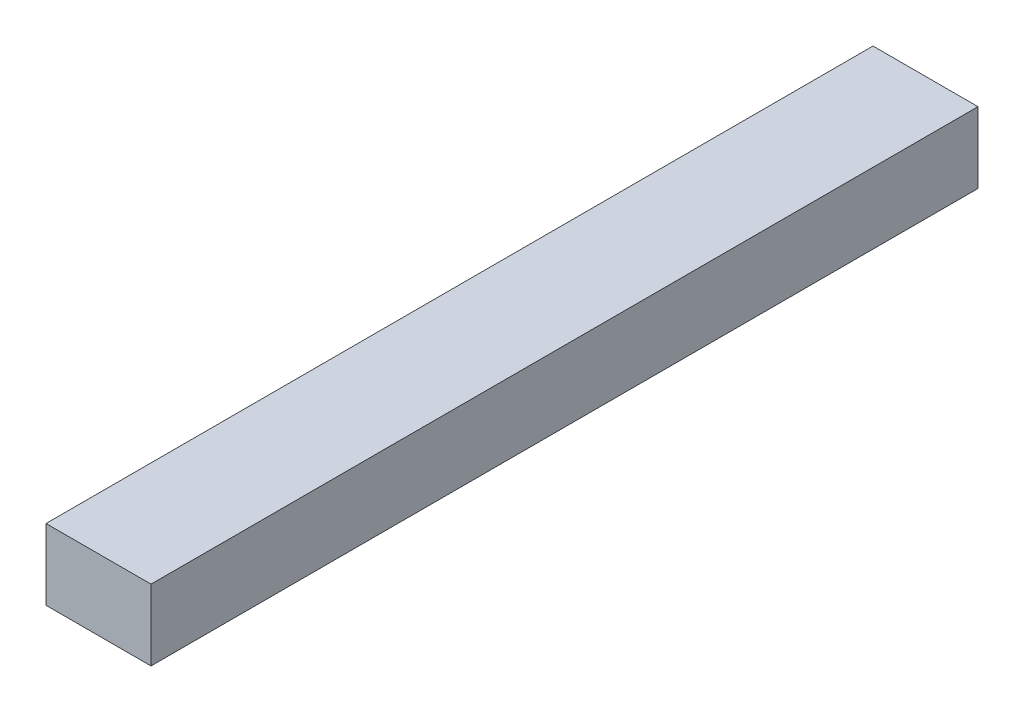
from build123d import *

# Parameters (mm, degrees)
SKETCH1_W           = 16
SKETCH1_H           = 126
BOSS_EXTRUDE1_DEPTH = 10.799999675


with BuildPart() as part:
    # Sketch1 → Boss-Extrude1 (new body)
    with BuildSketch(Plane.XZ.offset(29.999999675)):
        with Locations((68, -3)):
            Rectangle(SKETCH1_W, SKETCH1_H)
    extrude(amount=-BOSS_EXTRUDE1_DEPTH)


solid = part.part
